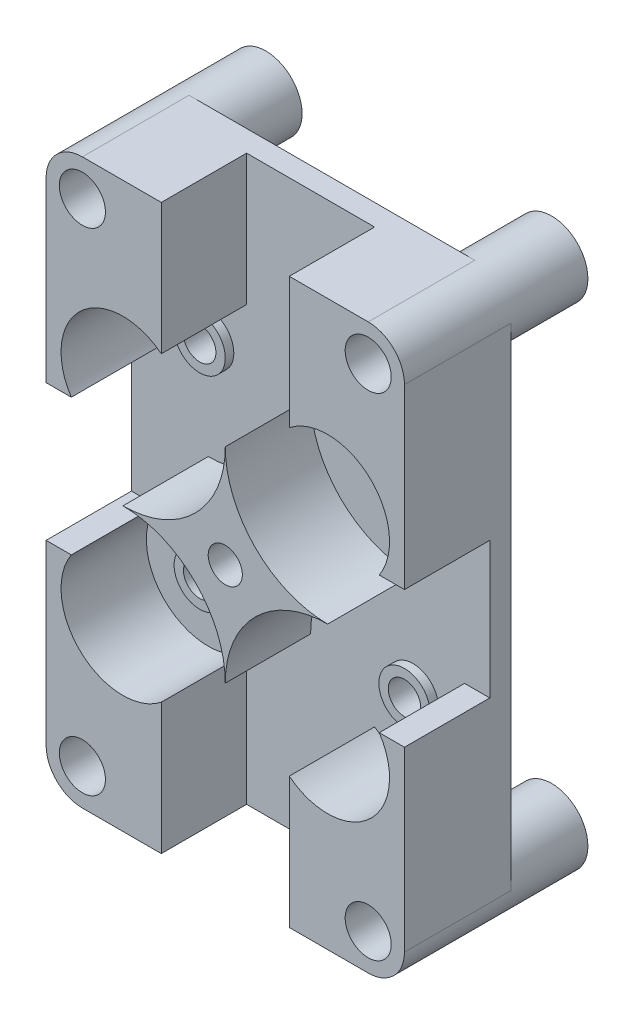
from build123d import *
from build123d.topology import SkipClean

# Parameters (mm, degrees)
SKETCH_1_R      = 1.9
SKETCH_1_R_2    = 2.7
SKETCH_1_R_3    = 2
EXTRUDE_1_DEPTH = 2.5
EXTRUDE_START   = -9
SKETCH_1_3_R    = 4.25
SKETCH_1_3_R_2  = 2.7
EXTRUDE_2_DEPTH = 9
SKETCH_2_R      = 3
SKETCH_2_R_2    = 1.9
EXTRUDE_4_DEPTH = 1
EXTRUDE_START_2 = 2.5
SKETCH_1_7_R    = 2.7
SKETCH_1_7_R_2  = 2
EXTRUDE_5_DEPTH = 10


with BuildPart() as part:
    # 草图1 → 凸台-拉伸1 (new body)
    with BuildSketch(Plane.XY):
        with BuildLine():
            ThreePointArc((-16.75, 33.05), (-19.75520382, 31.80520382), (-21, 28.8))
            Line((-21, 28.8), (-21, -28.8))
            ThreePointArc((-21, -28.8), (-19.75520382, -31.80520382), (-16.75, -33.05))
            Line((-16.75, -33.05), (16.75, -33.05))
            ThreePointArc((16.75, -33.05), (19.75520382, -31.80520382), (21, -28.8))
            Line((21, -28.8), (21, 28.8))
            ThreePointArc((21, 28.8), (19.75520382, 31.80520382), (16.75, 33.05))
            Line((16.75, 33.05), (-16.75, 33.05))
        make_face()
        with Locations((-12, 12)):
            Circle(SKETCH_1_R, mode=Mode.SUBTRACT)
        with Locations((-12, -12)):
            Circle(SKETCH_1_R, mode=Mode.SUBTRACT)
        with Locations((-16.75, 28.8)):
            Circle(SKETCH_1_R_2, mode=Mode.SUBTRACT)
        with Locations((-16.75, -28.8)):
            Circle(SKETCH_1_R_2, mode=Mode.SUBTRACT)
        with Locations((12, 12)):
            Circle(SKETCH_1_R, mode=Mode.SUBTRACT)
        with Locations((16.75, 28.8)):
            Circle(SKETCH_1_R_2, mode=Mode.SUBTRACT)
        with Locations((12, -12)):
            Circle(SKETCH_1_R, mode=Mode.SUBTRACT)
        with Locations((16.75, -28.8)):
            Circle(SKETCH_1_R_2, mode=Mode.SUBTRACT)
        Circle(SKETCH_1_R_3, mode=Mode.SUBTRACT)
    extrude(amount=EXTRUDE_1_DEPTH)

    # 草图1<3> → 凸台-拉伸2 (add)
    # profile 1 of 4: a face of its own
    with SkipClean():  # the faces are left unmerged after this step: merging them gives an invalid solid
        with BuildSketch(Plane.XY.offset(EXTRUDE_START)):
            with Locations(Location((-16.75, 28.8, 0), (0, 0, 180))):
                Circle(SKETCH_1_3_R)
            with Locations((-16.75, 28.8)):
                Circle(SKETCH_1_3_R_2, mode=Mode.SUBTRACT)
        # profile 2 of 4: a face of its own
        with BuildSketch(Plane.XY.offset(EXTRUDE_START)):
            with Locations(Location((-16.75, -28.8, 0), (0, 0, 180))):
                Circle(SKETCH_1_3_R)
            with Locations((-16.75, -28.8)):
                Circle(SKETCH_1_3_R_2, mode=Mode.SUBTRACT)
        # profile 3 of 4: a face of its own
        with BuildSketch(Plane.XY.offset(EXTRUDE_START)):
            with Locations((16.75, -28.8)):
                Circle(SKETCH_1_3_R)
            with Locations((16.75, -28.8)):
                Circle(SKETCH_1_3_R_2, mode=Mode.SUBTRACT)
        # profile 4 of 4: a face of its own
        with BuildSketch(Plane.XY.offset(EXTRUDE_START)):
            with Locations((16.75, 28.8)):
                Circle(SKETCH_1_3_R)
            with Locations((16.75, 28.8)):
                Circle(SKETCH_1_3_R_2, mode=Mode.SUBTRACT)
        extrude(amount=EXTRUDE_2_DEPTH)

    # 草图2 → 凸台-拉伸4 (add)
    # profile 1 of 4: a face of its own
    with SkipClean():  # the faces are left unmerged after this step: merging them gives an invalid solid
        with BuildSketch(Plane.XY.offset(2.5)):
            with Locations((-12, 12)):
                Circle(SKETCH_2_R)
            with Locations((-12, 12)):
                Circle(SKETCH_2_R_2, mode=Mode.SUBTRACT)
        # profile 2 of 4: a face of its own
        with BuildSketch(Plane.XY.offset(2.5)):
            with Locations(Location((12, 12, 0), (0, 0, 180))):
                Circle(SKETCH_2_R)
            with Locations(Location((12, 12, 0), (0, 0, 180))):
                Circle(SKETCH_2_R_2, mode=Mode.SUBTRACT)
        # profile 3 of 4: a face of its own
        with BuildSketch(Plane.XY.offset(2.5)):
            with Locations((12, -12)):
                Circle(SKETCH_2_R)
            with Locations((12, -12)):
                Circle(SKETCH_2_R_2, mode=Mode.SUBTRACT)
        # profile 4 of 4: a face of its own
        with BuildSketch(Plane.XY.offset(2.5)):
            with Locations(Location((-12, -12, 0), (0, 0, 180))):
                Circle(SKETCH_2_R)
            with Locations(Location((-12, -12, 0), (0, 0, 180))):
                Circle(SKETCH_2_R_2, mode=Mode.SUBTRACT)
        extrude(amount=EXTRUDE_4_DEPTH)

    # 草图1<7> → 凸台-拉伸5 (add)
    # profile 1 of 5: a face of its own
    with SkipClean():  # the faces are left unmerged after this step: merging them gives an invalid solid
        with BuildSketch(Plane.XY.offset(EXTRUDE_START_2)):
            with BuildLine():
                Line((-21, 8), (-18.046693311, 8))
                ThreePointArc((-18.046693311, 8), (-16.903570847, 17.34017724), (-7.5, 17.6844085))
                Line((-7.5, 17.6844085), (-7.5, 33.05))
                Line((-7.5, 33.05), (-16.75, 33.05))
                ThreePointArc((-16.75, 33.05), (-19.75520382, 31.80520382), (-21, 28.8))
                Line((-21, 28.8), (-21, 8))
            make_face()
            with Locations((-16.75, 28.8)):
                Circle(SKETCH_1_7_R, mode=Mode.SUBTRACT)
        # profile 2 of 5: a face of its own
        with BuildSketch(Plane.XY.offset(EXTRUDE_START_2)):
            with BuildLine():
                Line((-18.046693311, -8), (-21, -8))
                Line((-21, -8), (-21, -28.8))
                ThreePointArc((-21, -28.8), (-19.75520382, -31.80520382), (-16.75, -33.05))
                Line((-16.75, -33.05), (-7.5, -33.05))
                Line((-7.5, -33.05), (-7.5, -17.6844085))
                ThreePointArc((-7.5, -17.6844085), (-16.903570847, -17.34017724), (-18.046693311, -8))
            make_face()
            with Locations((-16.75, -28.8)):
                Circle(SKETCH_1_7_R, mode=Mode.SUBTRACT)
        # profile 3 of 5: a face of its own
        with BuildSketch(Plane.XY.offset(EXTRUDE_START_2)):
            with BuildLine():
                Line((7.5, 33.05), (7.5, 17.6844085))
                ThreePointArc((7.5, 17.6844085), (16.903570847, 17.34017724), (18.046693311, 8))
                Line((18.046693311, 8), (21, 8))
                Line((21, 8), (21, 28.8))
                ThreePointArc((21, 28.8), (19.75520382, 31.80520382), (16.75, 33.05))
                Line((16.75, 33.05), (7.5, 33.05))
            make_face()
            with Locations((16.75, 28.8)):
                Circle(SKETCH_1_7_R, mode=Mode.SUBTRACT)
        # profile 4 of 5: a face of its own
        with BuildSketch(Plane.XY.offset(EXTRUDE_START_2)):
            with BuildLine():
                Line((7.5, -17.6844085), (7.5, -33.05))
                Line((7.5, -33.05), (16.75, -33.05))
                ThreePointArc((16.75, -33.05), (19.75520382, -31.80520382), (21, -28.8))
                Line((21, -28.8), (21, -8))
                Line((21, -8), (18.046693311, -8))
                ThreePointArc((18.046693311, -8), (16.903570847, -17.34017724), (7.5, -17.6844085))
            make_face()
            with Locations((16.75, -28.8)):
                Circle(SKETCH_1_7_R, mode=Mode.SUBTRACT)
        # profile 5 of 5: a face of its own
        with BuildSketch(Plane.XY.offset(EXTRUDE_START_2)):
            with BuildLine():
                ThreePointArc((12.000001775, 0), (3.514719253, 3.514717998), (0, 12))
                ThreePointArc((0, 12), (-3.514717998, 3.514717478), (-12, -1.775e-06))
                ThreePointArc((-12, -1.775e-06), (-3.514717478, -3.514719773), (1.775e-06, -12.000001775))
                ThreePointArc((1.775e-06, -12.000001775), (3.514719773, -3.514719253), (12.000001775, 0))
            make_face()
            Circle(SKETCH_1_7_R_2, mode=Mode.SUBTRACT)
        extrude(amount=EXTRUDE_5_DEPTH)


solid = part.part
